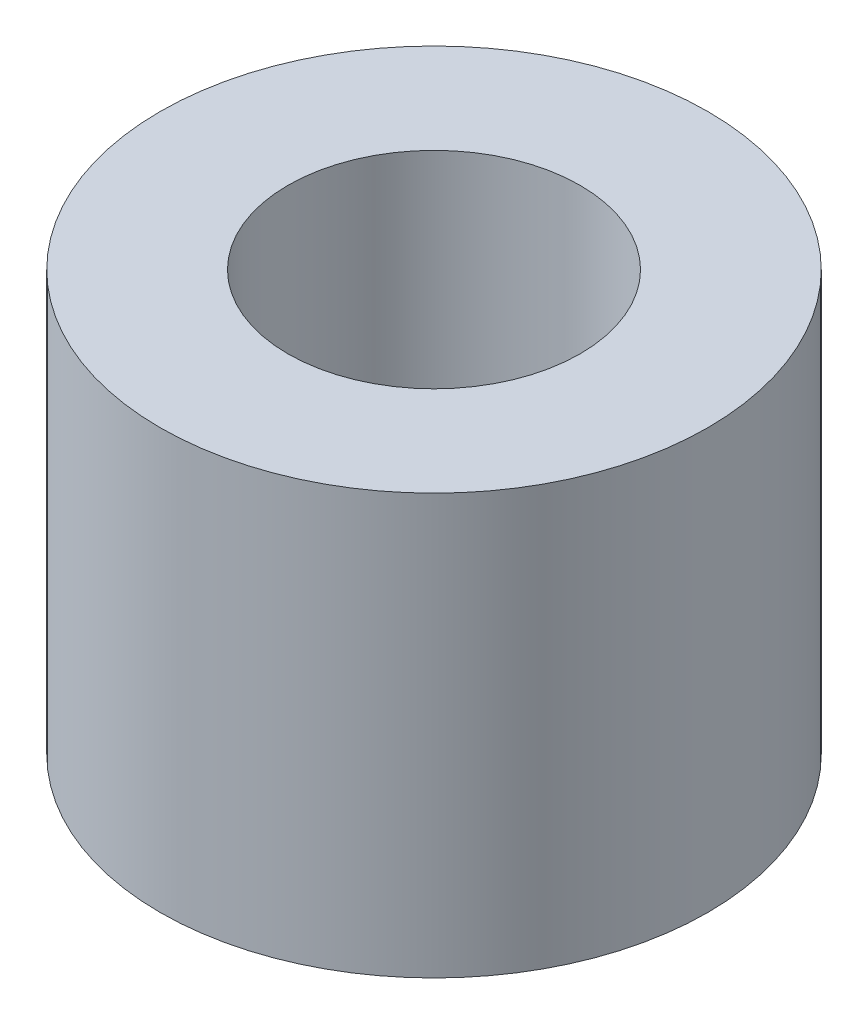
from build123d import *

# Parameters (mm, degrees)
CROQUIS1_R              = 3
CROQUIS1_R_2            = 1.6
SALIENTE_EXTRUIR1_DEPTH = 4.6


with BuildPart() as part:
    # Croquis1 → Saliente-Extruir1 (new body)
    with BuildSketch(Plane.XZ):
        with Locations(Location((0, 0, 0), (0, 0, 270))):
            Circle(CROQUIS1_R)
        with Locations(Location((0, 0, 0), (0, 0, 270))):
            Circle(CROQUIS1_R_2, mode=Mode.SUBTRACT)
    extrude(amount=-SALIENTE_EXTRUIR1_DEPTH)


solid = part.part
